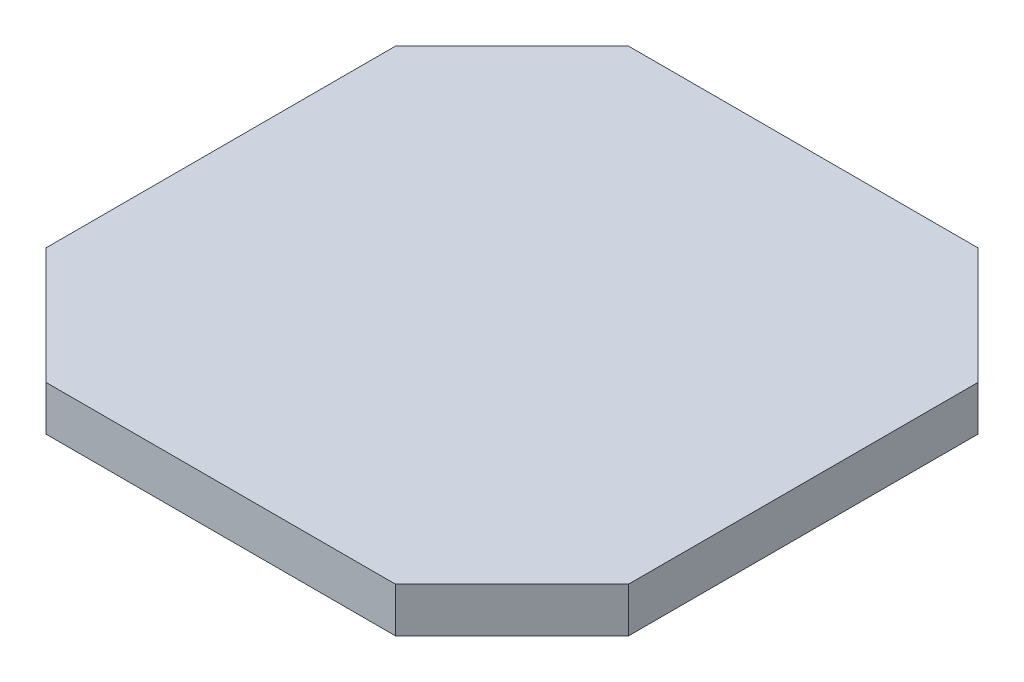
from build123d import *

# Parameters (mm, degrees)
BOSS_EXTRUDE1_DEPTH = 10


with BuildPart() as part:
    # Sketch1 → Boss-Extrude1 (new body)
    with BuildSketch(Plane(origin=(0, 0, 0), x_dir=(1, 0, 0), z_dir=(0, 1, 0))):
        Polygon((-65, 39), (-39, 65), (39, 65), (65, 39), (65, -39), (39, -65), (-39, -65), (-65, -39), align=None)
    extrude(amount=BOSS_EXTRUDE1_DEPTH)


solid = part.part
